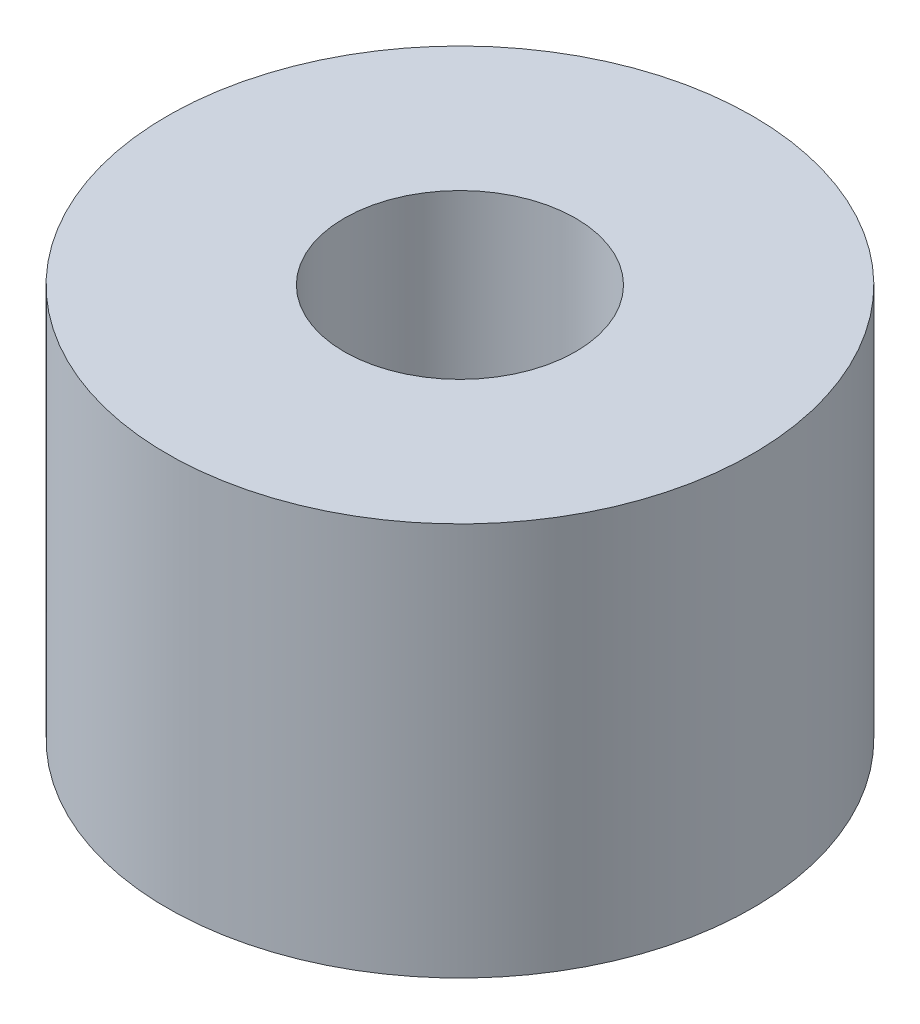
from build123d import *

# Parameters (mm, degrees)
SCHIZZO1_W = 2.295
SCHIZZO1_H = 5.1


with BuildPart() as part:
    # Schizzo1 → Rivoluzione1 (revolve)
    with BuildSketch(Plane.XY, mode=Mode.PRIVATE) as rivoluzione1_sk:
        with Locations((2.6475, 2.55)):
            Rectangle(SCHIZZO1_W, SCHIZZO1_H)
    revolve(rivoluzione1_sk.sketch.rotate(Axis((0, 0, 0), (0, 1, 0)), 90), axis=Axis((0, 0, 0), (0, 1, 0)))


solid = part.part
